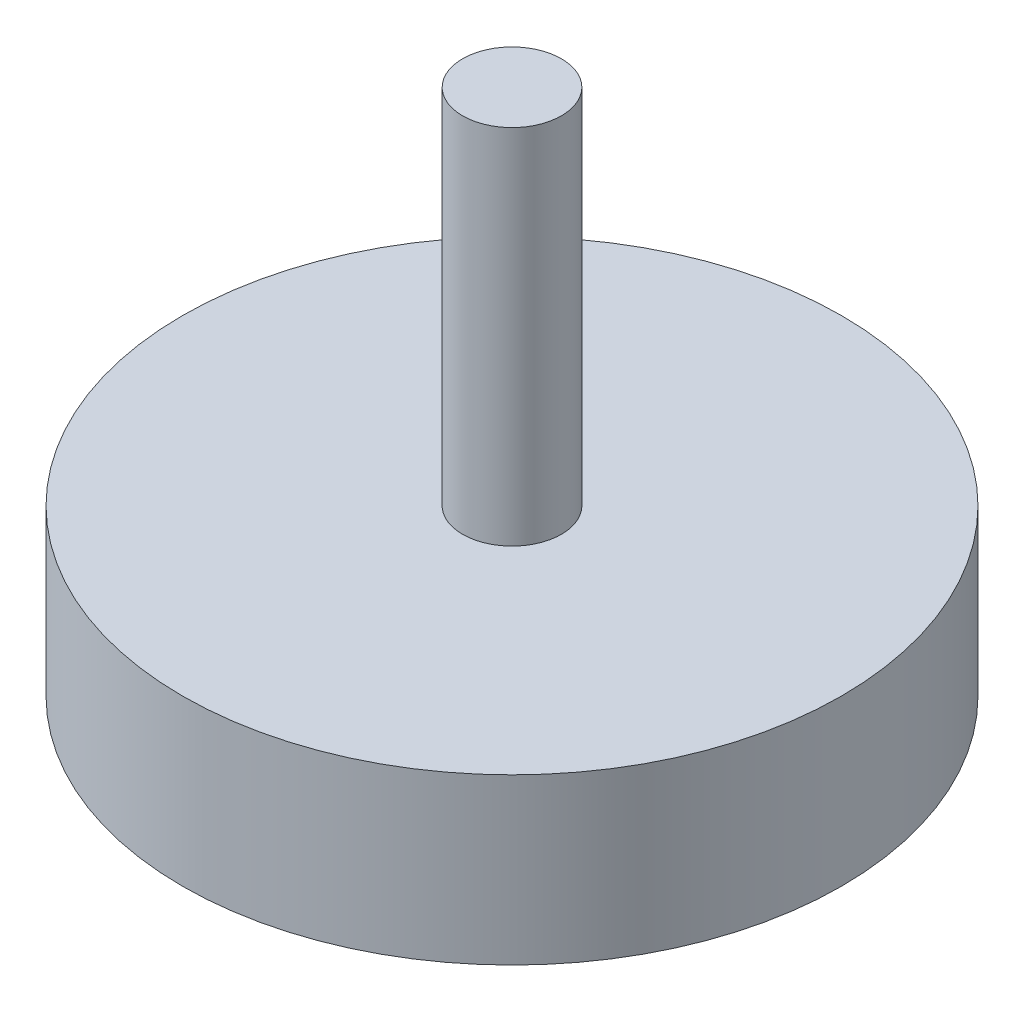
from build123d import *

# Parameters (mm, degrees)
SKETCH1_R           = 50
BOSS_EXTRUDE1_DEPTH = 25
SKETCH2_R           = 7.5
BOSS_EXTRUDE2_DEPTH = 55


with BuildPart() as part:
    # Sketch1 → Boss-Extrude1 (new body)
    with BuildSketch(Plane(origin=(0, 0, 0), x_dir=(1, 0, 0), z_dir=(0, 1, 0))):
        with Locations(Location((0, 0, 0), (0, 0, 270))):
            Circle(SKETCH1_R)
    extrude(amount=BOSS_EXTRUDE1_DEPTH)

    # Sketch2 → Boss-Extrude2 (add)
    with BuildSketch(Plane(origin=(0, 25, 0), x_dir=(1, 0, 0), z_dir=(0, 1, 0))):
        with Locations(Location((0, 0, 0), (0, 0, 270))):
            Circle(SKETCH2_R)
    extrude(amount=BOSS_EXTRUDE2_DEPTH)


solid = part.part
